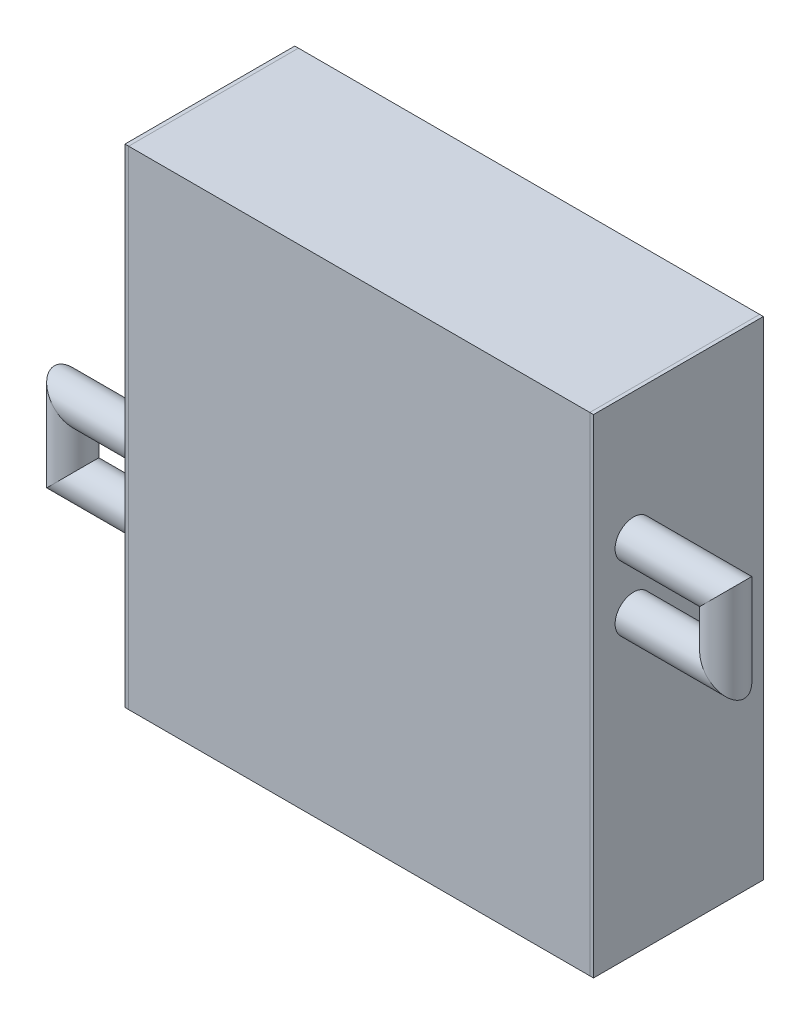
from build123d import *

# Parameters (mm, degrees)
SKETCH3_W             = 145
SKETCH3_H             = 0.3
BOSS_EXTRUDE1_DEPTH   = 1250
BOSS_EXTRUDE2_DEPTH   = 1250
BOSS_EXTRUDE2_2_DEPTH = 1250
BOSS_EXTRUDE2_3_DEPTH = 1250
SKETCH5_W             = 460.32256347
SKETCH5_H             = 1322.59999933
BOSS_EXTRUDE3_DEPTH   = 10
SKETCH6_W             = 460.32256347
SKETCH6_H             = 1322.59999933
BOSS_EXTRUDE5_DEPTH   = 10
SKETCH10_R            = 50
SKETCH12_R            = 50


with BuildPart() as part:
    # Sketch3 → Boss-Extrude1 (new body)
    with BuildSketch(Plane(origin=(0, 0, 0), x_dir=(0, 0, -1), z_dir=(1, 0, 0))):
        with BuildLine():
            add(Edge.make_bspline(
                [(2.48e-07, 3.35e-07), (55.488161595, 74.987946486), (168.36864354, 167.522485923)],
                knots=[0, 0, 0, 0.70182269, 0.70182269, 0.70182269], degree=2))
            add(Edge.make_bspline(
                [(168.36864354, 167.522485923), (216.32719333, 206.836831862), (274.645466506, 249.318463092)],
                knots=[0.70182269, 0.70182269, 0.70182269, 1, 1, 1], degree=2))
            Line((274.645466506, 249.318463092), (274.292192209, 249.803434504))
            add(Edge.make_bspline(
                [(0.6, 1.813912706), (1.431880585, 2.929500885), (3.098081699, 5.144557566), (6.522302801, 9.620243286), (10.936952293, 15.249635367), (16.461379679, 22.076486865), (24.125535977, 31.268787701), (34.266894078, 42.930262812), (47.333785728, 57.197157848), (61.298121724, 71.737552805), (81.11380395, 91.489513551), (108.127067674, 116.863737039), (138.132064611, 143.150935141), (163.931222819, 164.728757618), (184.178180647, 181.186197846), (205.322821331, 197.917810568), (223.69122823, 212.089176502), (238.835170676, 223.563652253), (250.41650891, 232.237308995), (260.257949546, 239.524898736), (268.235899963, 245.38385152), (272.275786984, 248.334595005), (274.292192209, 249.803434504)],
                knots=[0.504877401, 0.504877401, 0.504877401, 0.504877401, 0.504963051, 0.505048701, 0.505220001, 0.505391301, 0.505562601, 0.505905201, 0.506247801, 0.5065904, 0.506933, 0.5076182, 0.508303399, 0.508645999, 0.508988599, 0.509331199, 0.509673799, 0.509845099, 0.510016398, 0.510187698, 0.510273348, 0.510358998, 0.510358998, 0.510358998, 0.510358998], degree=3))
            Line((0.6, 1.813912706), (0.6, 145))
            Line((0.6, 145), (0, 145))
            Line((0, 145), (0, 144.7))
            Line((1e-09, 144.7), (2.48e-07, 3.35e-07))
        make_face()
        Polygon((0, 255), (0, 145), (0.6, 145), (10, 145), (10, 265), (-155, 265), (-155, 145), (-145.6, 145), (-145, 145), (-145, 255), align=None)
        with Locations((-72.5, 144.85)):
            Rectangle(SKETCH3_W, SKETCH3_H)
        with BuildLine():
            add(Edge.make_bspline(
                [(274.864177844, -81.240254391), (273.157555823, -81.908314485), (269.733829537, -83.241505299), (262.941654289, -85.858117417), (254.510317822, -89.053086213), (244.50096298, -92.760277041), (231.294495376, -97.536119599), (215.049955023, -103.191748393), (195.977414467, -109.476093263), (177.325927798, -115.257936974), (153.018554388, -122.297060264), (123.686593004, -129.839640987), (90.171547783, -136.880361962), (63.644156709, -141.071994361), (43.264196312, -143.419639805), (28.397236209, -144.677451966), (16.366230175, -145.306441238), (6.934113164, -145.558059675), (2.319957621, -145.600000001), (-1.73e-07, -145.6)],
                knots=[0.503870094, 0.503870094, 0.503870094, 0.503870094, 0.50394168, 0.504013267, 0.50415644, 0.504299613, 0.504442786, 0.504729131, 0.505015477, 0.505301823, 0.505588169, 0.506160861, 0.506733552, 0.507306244, 0.50759259, 0.507878936, 0.508165281, 0.508308454, 0.508451627, 0.508451627, 0.508451627, 0.508451627], degree=3))
            ThreePointArc((-1.73e-07, -145.6), (-102.954747402, -102.95474728), (-145.6, 0))
            Line((-145.6, 0), (-145.6, 145))
            Line((-145.6, 145), (-145, 145))
            Line((-145, 145), (-145, 0))
            ThreePointArc((-145, 0), (-102.530483394, -102.53048315), (-3.45e-07, -145))
            add(Edge.make_bspline(
                [(-3.45e-07, -145), (110.337933623, -145.000000101), (274.645466839, -80.681536666)],
                knots=[0, 0, 0, 1, 1, 1], degree=2))
            Line((274.645466839, -80.681536666), (274.864177844, -81.240254391))
        make_face()
        Polygon((274.645466839, -80.681536666), (168.36864354, 167.522485923), (172.045740171, 169.09695738), (278.32256347, -79.107065209), align=None)
        with BuildLine():
            Line((-145, 574.999999665), (-145.6, 574.999999665))
            Line((-145.6, 574.999999665), (-145.6, 429.999999665))
            ThreePointArc((-145.6, 429.999999665), (-102.954747402, 327.045252385), (-1.73e-07, 284.399999665))
            add(Edge.make_bspline(
                [(274.864177844, 348.759745274), (273.157555823, 348.09168518), (269.733829537, 346.758494366), (262.941654289, 344.141882248), (254.510317822, 340.946913452), (244.50096298, 337.239722624), (231.294495376, 332.463880066), (215.049955023, 326.808251272), (195.977414467, 320.523906402), (177.325927798, 314.742062691), (153.018554388, 307.702939401), (123.686593004, 300.160358678), (90.171547783, 293.119637703), (63.644156709, 288.928005304), (43.264196312, 286.58035986), (28.397236209, 285.322547699), (16.366230175, 284.693558427), (6.934113164, 284.44193999), (2.319957621, 284.399999664), (-1.73e-07, 284.399999665)],
                knots=[0.503870094, 0.503870094, 0.503870094, 0.503870094, 0.50394168, 0.504013267, 0.50415644, 0.504299613, 0.504442786, 0.504729131, 0.505015477, 0.505301823, 0.505588169, 0.506160861, 0.506733552, 0.507306244, 0.50759259, 0.507878936, 0.508165281, 0.508308454, 0.508451627, 0.508451627, 0.508451627, 0.508451627], degree=3))
            Line((274.864177844, 348.759745274), (274.645466839, 349.318462999))
            add(Edge.make_bspline(
                [(-3.45e-07, 284.999999665), (110.337933732, 284.999999565), (274.645466839, 349.318462999)],
                knots=[0, 0, 0, 1, 1, 1], degree=2))
            ThreePointArc((-3.45e-07, 284.999999665), (-102.530483226, 327.469516682), (-145, 429.999999665))
            Line((-145, 429.999999665), (-145, 574.699999665))
            Line((-145, 574.699999665), (-145, 574.999999665))
        make_face()
        Polygon((168.36864354, 597.522485588), (172.045740171, 599.096957045), (278.32256347, 350.892934456), (274.645466839, 349.318462999), align=None)
        with BuildLine():
            Line((0.6, 574.999999665), (0, 574.999999665))
            Line((0, 574.999999665), (0, 574.699999665))
            Line((0, 574.699999665), (0, 430))
            add(Edge.make_bspline(
                [(0, 430), (55.488161478, 504.987946171), (168.368643516, 597.522485618)],
                knots=[0, 0, 0, 0.70182269, 0.70182269, 0.70182269], degree=2))
            add(Edge.make_bspline(
                [(168.368643516, 597.522485618), (216.327193325, 636.836831544), (274.645466506, 679.318462757)],
                knots=[0.70182269, 0.70182269, 0.70182269, 1, 1, 1], degree=2))
            Line((274.645466506, 679.318462757), (274.292192209, 679.803434169))
            add(Edge.make_bspline(
                [(0.6, 431.813912371), (1.431880585, 432.92950055), (3.098081699, 435.144557231), (6.522302801, 439.620242951), (10.936952293, 445.249635032), (16.461379679, 452.07648653), (24.125535977, 461.268787366), (34.266894078, 472.930262477), (47.333785728, 487.197157513), (61.298121724, 501.73755247), (81.11380395, 521.489513216), (108.127067674, 546.863736704), (138.132064611, 573.150934806), (163.931222819, 594.728757283), (184.178180647, 611.186197511), (205.322821331, 627.917810233), (223.69122823, 642.089176167), (238.835170676, 653.563651918), (250.41650891, 662.23730866), (260.257949546, 669.524898401), (268.235899963, 675.383851185), (272.275786984, 678.33459467), (274.292192209, 679.803434169)],
                knots=[0.504877401, 0.504877401, 0.504877401, 0.504877401, 0.504963051, 0.505048701, 0.505220001, 0.505391301, 0.505562601, 0.505905201, 0.506247801, 0.5065904, 0.506933, 0.5076182, 0.508303399, 0.508645999, 0.508988599, 0.509331199, 0.509673799, 0.509845099, 0.510016398, 0.510187698, 0.510273348, 0.510358998, 0.510358998, 0.510358998, 0.510358998], degree=3))
            Line((0.6, 431.813912371), (0.6, 574.999999665))
        make_face()
        Polygon((-155, 574.999999665), (-155, 694.999999665), (10, 694.999999665), (10, 574.999999665), (0, 574.999999665), (0, 684.999999665), (-145, 684.999999665), (-145, 574.999999665), align=None)
        with Locations((-72.5, 574.849999665)):
            Rectangle(SKETCH3_W, SKETCH3_H)
        Polygon((168.36864354, 1027.522485253), (172.045740171, 1029.09695671), (278.32256347, 780.892934121), (274.645466839, 779.318462664), align=None)
        with BuildLine():
            Line((-145, 1004.99999933), (-145.6, 1004.99999933))
            Line((-145.6, 1004.99999933), (-145.6, 859.99999933))
            ThreePointArc((-145.6, 859.99999933), (-102.954747402, 757.04525205), (-1.73e-07, 714.39999933))
            add(Edge.make_bspline(
                [(274.864177844, 778.759744939), (273.157555823, 778.091684845), (269.733829537, 776.758494031), (262.941654289, 774.141881913), (254.510317822, 770.946913117), (244.50096298, 767.239722289), (231.294495376, 762.463879731), (215.049955023, 756.808250937), (195.977414467, 750.523906067), (177.325927798, 744.742062356), (153.018554388, 737.702939066), (123.686593004, 730.160358343), (90.171547783, 723.119637368), (63.644156709, 718.928004969), (43.264196312, 716.580359525), (28.397236209, 715.322547364), (16.366230175, 714.693558092), (6.934113164, 714.441939655), (2.319957621, 714.399999329), (-1.73e-07, 714.39999933)],
                knots=[0.503870094, 0.503870094, 0.503870094, 0.503870094, 0.50394168, 0.504013267, 0.50415644, 0.504299613, 0.504442786, 0.504729131, 0.505015477, 0.505301823, 0.505588169, 0.506160861, 0.506733552, 0.507306244, 0.50759259, 0.507878936, 0.508165281, 0.508308454, 0.508451627, 0.508451627, 0.508451627, 0.508451627], degree=3))
            Line((274.864177844, 778.759744939), (274.645466839, 779.318462664))
            add(Edge.make_bspline(
                [(-3.45e-07, 714.99999933), (110.337933732, 714.999999229), (274.645466839, 779.318462664)],
                knots=[0, 0, 0, 1, 1, 1], degree=2))
            ThreePointArc((-3.45e-07, 714.99999933), (-102.530483226, 757.469516348), (-145, 859.99999933))
            Line((-145, 859.99999933), (-145, 1004.69999933))
            Line((-145, 1004.69999933), (-145, 1004.99999933))
        make_face()
        with BuildLine():
            Line((0.6, 1004.99999933), (0, 1004.99999933))
            Line((0, 1004.99999933), (0, 1004.69999933))
            Line((0, 1004.69999933), (0, 859.999999665))
            add(Edge.make_bspline(
                [(0, 859.999999665), (55.488161478, 934.987945836), (168.368643516, 1027.522485283)],
                knots=[0, 0, 0, 0.70182269, 0.70182269, 0.70182269], degree=2))
            add(Edge.make_bspline(
                [(168.368643516, 1027.522485283), (216.327193325, 1066.836831209), (274.645466506, 1109.318462422)],
                knots=[0.70182269, 0.70182269, 0.70182269, 1, 1, 1], degree=2))
            Line((274.645466506, 1109.318462422), (274.292192209, 1109.803433834))
            add(Edge.make_bspline(
                [(0.6, 861.813912036), (1.431880585, 862.929500215), (3.098081699, 865.144556896), (6.522302801, 869.620242616), (10.936952293, 875.249634697), (16.461379679, 882.076486195), (24.125535977, 891.268787031), (34.266894078, 902.930262142), (47.333785728, 917.197157178), (61.298121724, 931.737552135), (81.11380395, 951.489512881), (108.127067674, 976.863736369), (138.132064611, 1003.150934471), (163.931222819, 1024.728756948), (184.178180647, 1041.186197176), (205.322821331, 1057.917809898), (223.69122823, 1072.089175832), (238.835170676, 1083.563651583), (250.41650891, 1092.237308325), (260.257949546, 1099.524898066), (268.235899963, 1105.38385085), (272.275786984, 1108.334594335), (274.292192209, 1109.803433834)],
                knots=[0.504877401, 0.504877401, 0.504877401, 0.504877401, 0.504963051, 0.505048701, 0.505220001, 0.505391301, 0.505562601, 0.505905201, 0.506247801, 0.5065904, 0.506933, 0.5076182, 0.508303399, 0.508645999, 0.508988599, 0.509331199, 0.509673799, 0.509845099, 0.510016398, 0.510187698, 0.510273348, 0.510358998, 0.510358998, 0.510358998, 0.510358998], degree=3))
            Line((0.6, 861.813912036), (0.6, 1004.99999933))
        make_face()
        with Locations((-72.5, 1004.84999933)):
            Rectangle(SKETCH3_W, SKETCH3_H)
        Polygon((-155, 1004.99999933), (-155, 1124.99999933), (10, 1124.99999933), (10, 1004.99999933), (0, 1004.99999933), (0, 1114.99999933), (-145, 1114.99999933), (-145, 1004.99999933), align=None)
    extrude(amount=-BOSS_EXTRUDE1_DEPTH)


with BuildPart() as body_2:
    # Sketch4 → Boss-Extrude2 (new body)
    with BuildSketch(Plane(origin=(0, 0, 0), x_dir=(0, 0, -1), z_dir=(1, 0, 0))):
        Polygon((-180, 1149.99999933), (278.32256347, 1149.99999933), (278.32256347, 1109.318462422), (274.645466506, 1109.318462422), (274.645466506, 1108.318462422), (279.32256347, 1108.318462422), (279.32256347, 1150.99999933), (-181, 1150.99999933), (-181, -171.6), (279.32256347, -171.6), (279.32256347, -79.107065209), (278.32256347, -79.107065209), (278.32256347, -170.6), (-180, -170.6), align=None)
    extrude(amount=-BOSS_EXTRUDE2_DEPTH)


with BuildPart() as body_3:
    # Sketch4 → Boss-Extrude2 2 (new body)
    with BuildSketch(Plane(origin=(0, 0, 0), x_dir=(0, 0, -1), z_dir=(1, 0, 0))):
        Polygon((274.645466506, 679.318462757), (278.32256347, 679.318462757), (278.32256347, 780.892934121), (279.32256347, 780.892934121), (279.32256347, 678.318462757), (274.645466506, 678.318462757), align=None)
    extrude(amount=-BOSS_EXTRUDE2_2_DEPTH)


with BuildPart() as body_4:
    # Sketch4 → Boss-Extrude2 3 (new body)
    with BuildSketch(Plane(origin=(0, 0, 0), x_dir=(0, 0, -1), z_dir=(1, 0, 0))):
        Polygon((274.645466506, 249.318463092), (278.32256347, 249.318463092), (278.32256347, 350.892934456), (279.32256347, 350.892934456), (279.32256347, 248.318463092), (274.645466506, 248.318463092), align=None)
    extrude(amount=-BOSS_EXTRUDE2_3_DEPTH)


with BuildPart() as body_5:
    # Sketch5 → Boss-Extrude3 (new body)
    with BuildSketch(Plane(origin=(0, 0, 0), x_dir=(0, 0, -1), z_dir=(1, 0, 0))):
        with Locations((49.161281735, 489.699999665)):
            Rectangle(SKETCH5_W, SKETCH5_H)
    extrude(amount=BOSS_EXTRUDE3_DEPTH)

    # Sweep4: sweep along a path in Sketch11
    with BuildLine(Plane.XY.offset(72.5)) as sweep4_path:
        Line((10, 630), (260, 630))
        Line((260, 630), (260, 806.299137657))
        Line((260, 806.299137657), (10, 806.299137657))
    # Sketch12 → Sweep4 (sweep)
    with BuildSketch(Plane(origin=(10, 0, 0), x_dir=(0, 0, -1), z_dir=(1, 0, 0))):
        with Locations((-72.5, 630)):
            Circle(SKETCH12_R)
    sweep(path=sweep4_path.line, transition=Transition.RIGHT)


with BuildPart() as body_6:
    # Sketch6 → Boss-Extrude5 (new body)
    with BuildSketch(Plane.ZY.offset(1250)):
        with Locations((-49.161281735, 489.699999665)):
            Rectangle(SKETCH6_W, SKETCH6_H)
    extrude(amount=BOSS_EXTRUDE5_DEPTH)

    # Sweep3: sweep along a path in Sketch9
    with BuildLine(Plane.XY.offset(72.5)) as sweep3_path:
        Line((-1260, 200), (-1510, 200))
        Line((-1510, 200), (-1510, 376.299137657))
        Line((-1510, 376.299137657), (-1260, 376.299137657))
    # Sketch10 → Sweep3 (sweep)
    with BuildSketch(Plane.ZY.offset(1260)):
        with Locations((72.5, 200)):
            Circle(SKETCH10_R)
    sweep(path=sweep3_path.line, transition=Transition.RIGHT)


solid = Compound([part.part, body_2.part, body_3.part, body_4.part, body_5.part, body_6.part])
